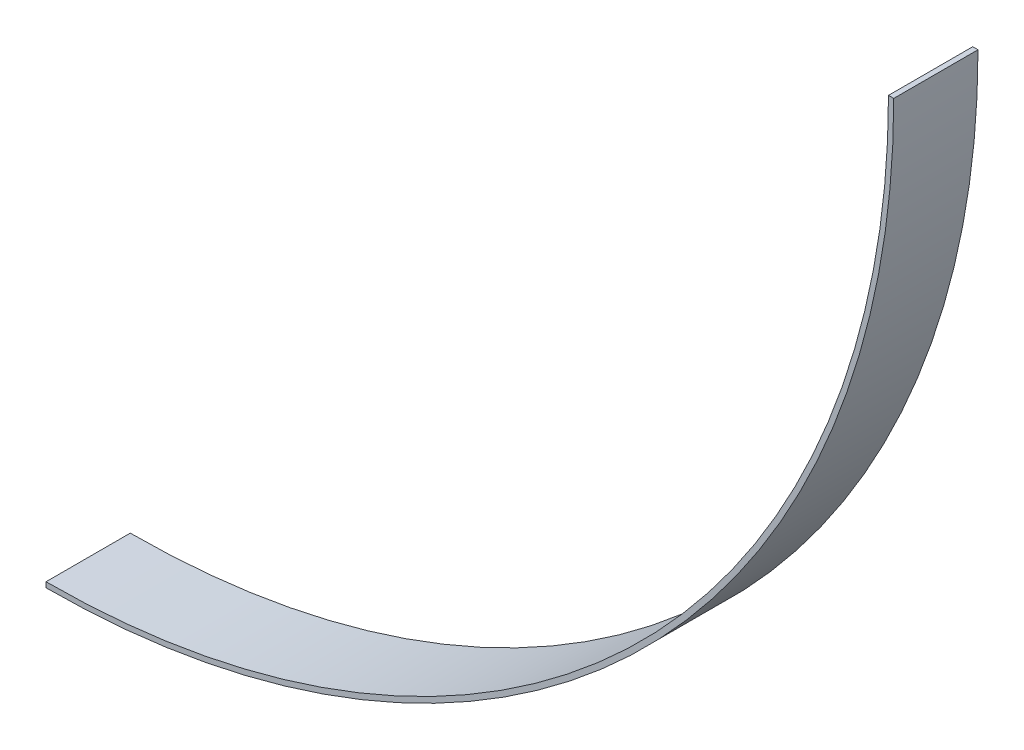
from build123d import *

# Parameters (mm, degrees)
BOSS_EXTRUDE1_DEPTH = 25.4


with BuildPart() as part:
    # Sketch1 → Boss-Extrude1 (new body)
    with BuildSketch(Plane.XY):
        with BuildLine():
            Line((0, -254), (0, -255.5875))
            ThreePointArc((0, -255.5875), (180.727654437, -180.727654437), (255.5875, 0))
            Line((255.5875, 0), (254, 0))
            ThreePointArc((254, 0), (179.605122421, -179.605122421), (0, -254))
        make_face()
    extrude(amount=BOSS_EXTRUDE1_DEPTH)


solid = part.part
